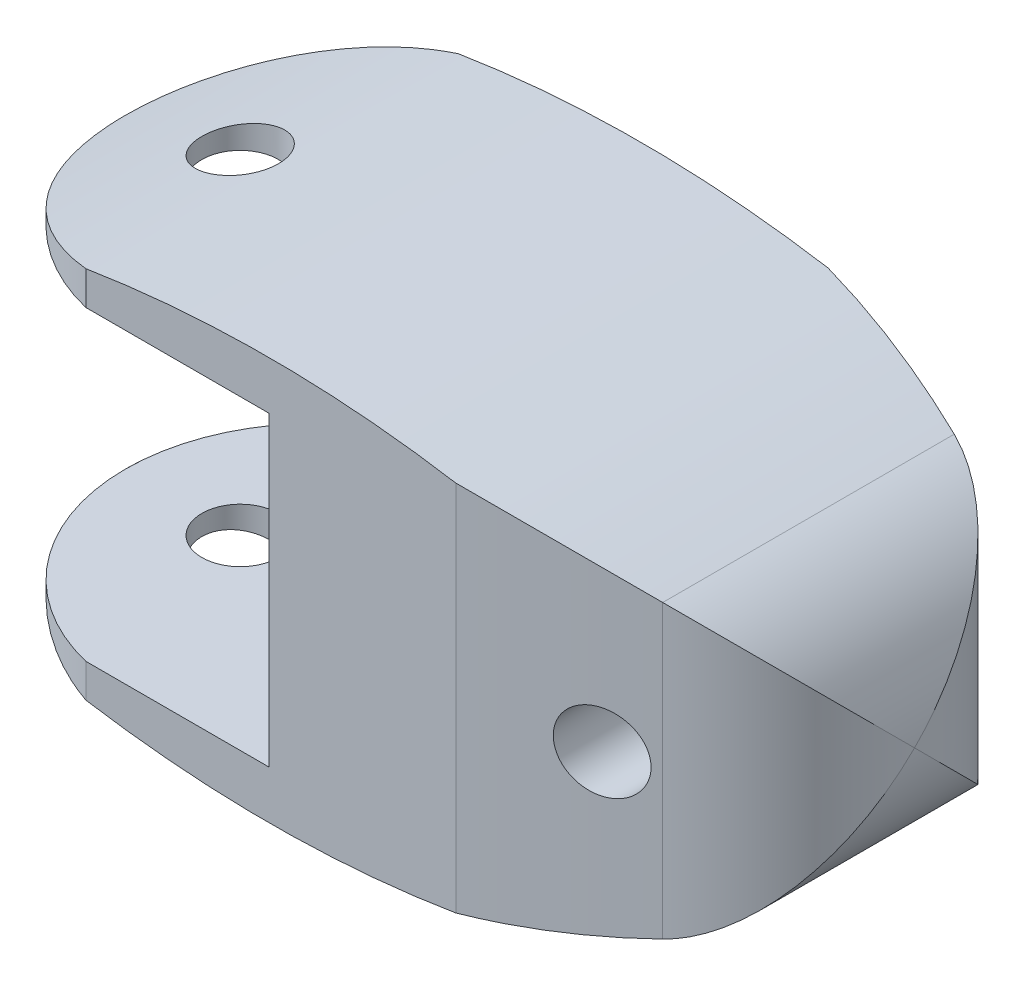
from build123d import *

# Parameters (mm, degrees)
CROQUIS1_R                 = 0.5
SALIENTE_EXTRUIR1_DEPTH    = 6
CORTAR_EXTRUIR6_DEPTH      = 9.883720712
CORTAR_EXTRUIR6_DEPTH_BACK = 9.883720712
CROQUIS3_W                 = 6
CROQUIS3_H                 = 4
CORTAR_EXTRUIR2_DEPTH      = 9.509571903
CORTAR_EXTRUIR7_DEPTH      = 9.509571903
CORTAR_EXTRUIR7_DEPTH_BACK = 9.509571903
CORTAR_EXTRUIR1_DEPTH      = 9.509571933
CORTAR_EXTRUIR1_DEPTH_BACK = 9.509571933
CROQUIS2_R                 = 0.5


with BuildPart() as part:
    # Croquis1 → Saliente-Extruir1 (new body)
    with BuildSketch(Plane.XY):
        with BuildLine():
            ThreePointArc((-4.615384615, 1.902971827), (-6, 0), (-4.615384615, -1.902971827))
            ThreePointArc((-4.615384615, -1.902971827), (0, -2.630683123), (4.615384615, -1.902971827))
            ThreePointArc((4.615384615, -1.902971827), (6, 0), (4.615384615, 1.902971827))
            ThreePointArc((4.615384615, 1.902971827), (0, 2.630683123), (-4.615384615, 1.902971827))
        make_face()
        with Locations((4, 0)):
            Circle(CROQUIS1_R, mode=Mode.SUBTRACT)
    extrude(amount=SALIENTE_EXTRUIR1_DEPTH)

    # Croquis7 → Cortar-Extruir6 (cut, two sides: drawn at the far end of the back side and taken through both)
    with BuildSketch(Plane(origin=(0, 0, 0), x_dir=(1, 0, 0), z_dir=(0, 1, 0)).offset(-CORTAR_EXTRUIR6_DEPTH_BACK)):
        Polygon((-6, 0), (6, 0), (6, -3), (6, -6), (-6, -6), (-6, -3), align=None)
        with BuildLine():
            Line((-2.441311123, -5.430683123), (2.441311123, -5.430683123))
            ThreePointArc((2.441311123, -5.430683123), (3.538199894, -5.207416005), (4.615384615, -4.902971827))
            ThreePointArc((4.615384615, -4.902971827), (6, -3), (4.615384615, -1.097028173))
            ThreePointArc((4.615384615, -1.097028173), (3.538199894, -0.792583995), (2.441311123, -0.569316877))
            Line((2.441311123, -0.569316877), (-2.441311123, -0.569316877))
            ThreePointArc((-2.441311123, -0.569316877), (-3.538199894, -0.792583995), (-4.615384615, -1.097028173))
            ThreePointArc((-4.615384615, -1.097028173), (-6, -3), (-4.615384615, -4.902971827))
            ThreePointArc((-4.615384615, -4.902971827), (-3.538199894, -5.207416005), (-2.441311123, -5.430683123))
        make_face(mode=Mode.SUBTRACT)
    extrude(amount=CORTAR_EXTRUIR6_DEPTH + CORTAR_EXTRUIR6_DEPTH_BACK, mode=Mode.SUBTRACT)

    # Croquis3 → Cortar-Extruir2 (cut, through all)
    with BuildSketch(Plane.XY):
        with Locations((-3, 0)):
            Rectangle(CROQUIS3_W, CROQUIS3_H)
    extrude(amount=CORTAR_EXTRUIR2_DEPTH, mode=Mode.SUBTRACT)

    # Croquis4 → Cortar-Extruir7 (cut, two sides: drawn at the far end of the back side and taken through both)
    with BuildSketch(Plane(origin=(0, 0, 0), x_dir=(1, 0, 0), z_dir=(0, 1, 0)).offset(-CORTAR_EXTRUIR7_DEPTH_BACK)):
        with BuildLine():
            ThreePointArc((-2.164743401, -0.526342579), (-3.242933174, -0.724065618), (-4.303804421, -1))
            Line((-4.303804421, -1), (-4.303804421, -3))
            ThreePointArc((-4.303804421, -3), (-3.694875017, -1.364872858), (-2.164743401, -0.526342579))
        make_face()
        with BuildLine():
            ThreePointArc((-2.164743401, -5.473657421), (-3.694875017, -4.635127142), (-4.303804421, -3))
            Line((-4.303804421, -3), (-4.303804421, -5))
            ThreePointArc((-4.303804421, -5), (-3.242933174, -5.275934382), (-2.164743401, -5.473657421))
        make_face()
    extrude(amount=CORTAR_EXTRUIR7_DEPTH + CORTAR_EXTRUIR7_DEPTH_BACK, mode=Mode.SUBTRACT)

    # Croquis2 → Cortar-Extruir1 (cut, two sides: drawn at the far end of the back side and taken through both)
    with BuildSketch(Plane(origin=(0, 0, 0), x_dir=(1, 0, 0), z_dir=(0, 1, 0)).offset(-CORTAR_EXTRUIR1_DEPTH_BACK)):
        with Locations(Location((-2.803804421, -3, 0), (0, 0, 270))):
            Circle(CROQUIS2_R)
    extrude(amount=CORTAR_EXTRUIR1_DEPTH + CORTAR_EXTRUIR1_DEPTH_BACK, mode=Mode.SUBTRACT)


solid = part.part
